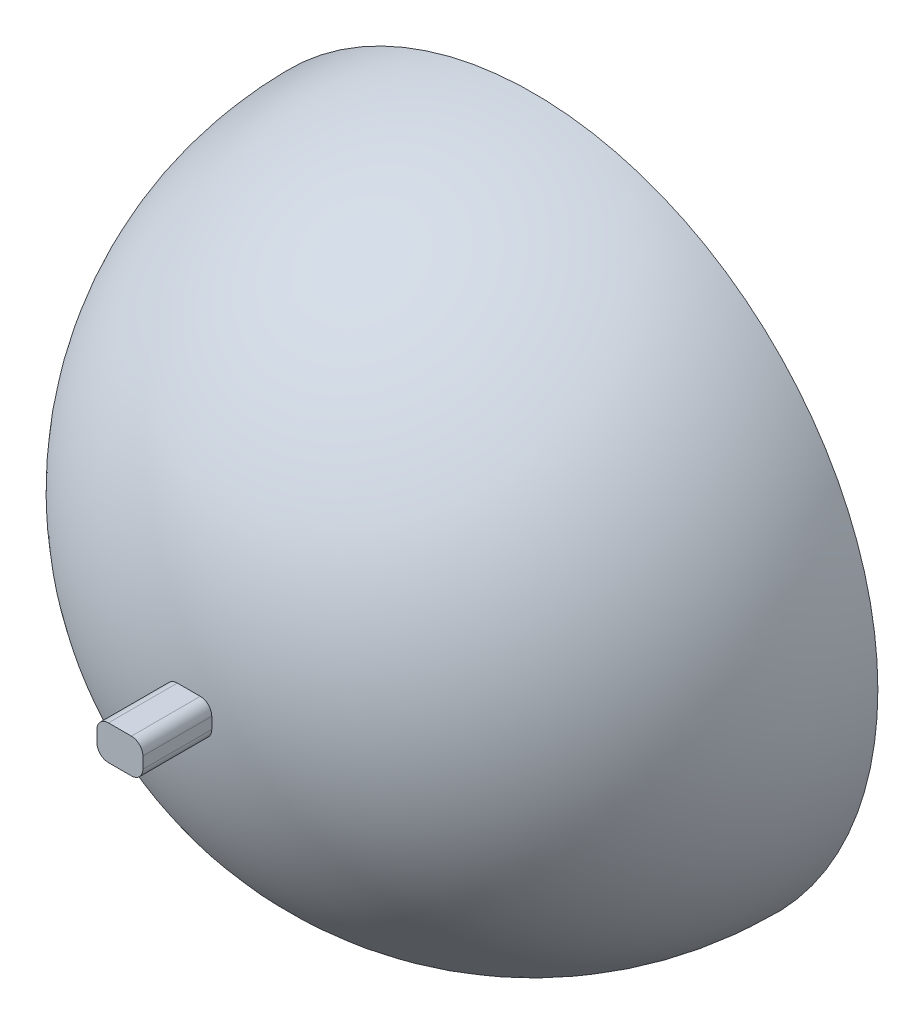
from build123d import *

# Parameters (mm, degrees)
REVOLVE1_ANGLE      = 180
SKETCH11_W          = 3
SKETCH11_H          = 1.5
BOSS_EXTRUDE4_DEPTH = 1
FILLET1_R           = 0.5


with BuildPart() as part:
    # Sketch3 → Revolve1 (revolve)
    with BuildSketch(Plane.XY):
        with BuildLine():
            Line((0, 0), (0, 30))
            ThreePointArc((0, 30), (-15, 15), (0, 0))
        make_face()
    revolve(axis=Axis((0, 0, 0), (0, 1, 0)), revolution_arc=REVOLVE1_ANGLE)


with BuildPart() as body_2:
    # Sketch11 → Boss-Extrude4 (new, symmetric)
    with BuildSketch(Plane(origin=(0, 0, 0), x_dir=(0, 0, -1), z_dir=(1, 0, 0))):
        with Locations((-16.5, 14.25)):
            Rectangle(SKETCH11_W, SKETCH11_H)
    extrude(amount=BOSS_EXTRUDE4_DEPTH, both=True)

    # Fillet1
    fillet1_edges = [body_2.edges().sort_by_distance(p)[0] for p in [
        (1, 13.5, 16.5),
        (-1, 13.5, 16.5),
        (-1, 15, 16.5),
        (1, 15, 16.5),
    ]]
    fillet(fillet1_edges, radius=FILLET1_R)


solid = Compound([part.part, body_2.part])
